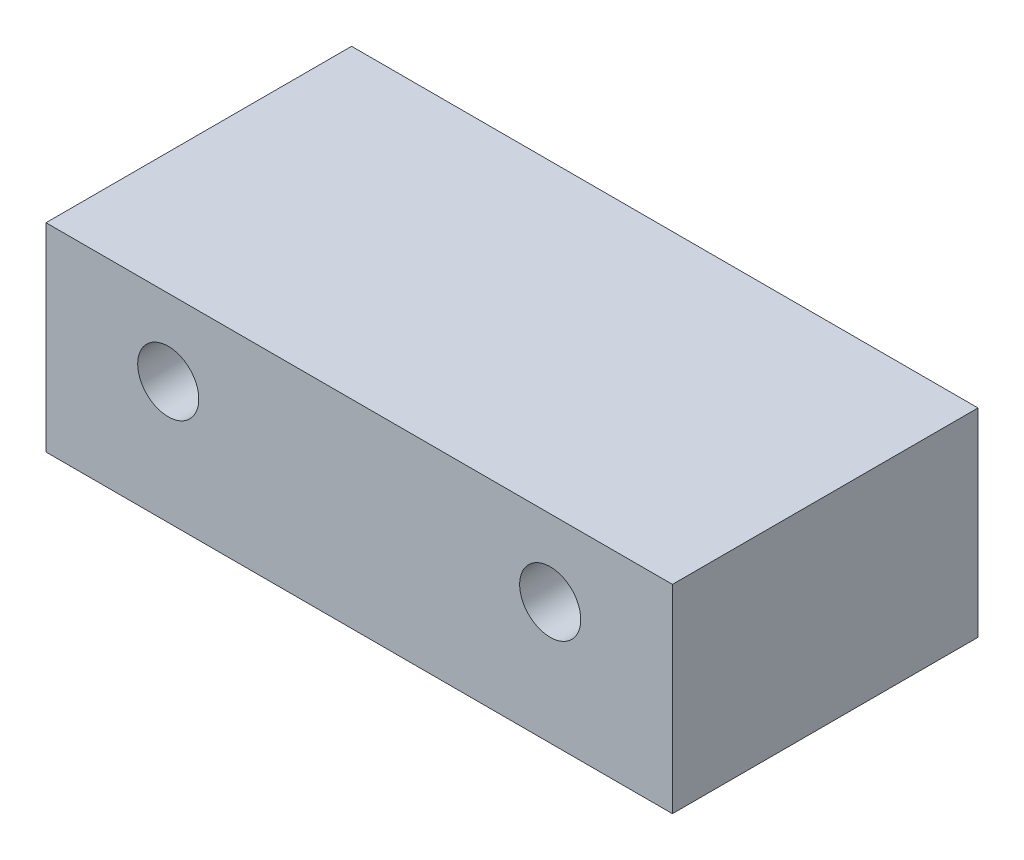
from build123d import *

# Parameters (mm, degrees)
SKETCH_1_W      = 41
SKETCH_1_H      = 10
SKETCH_1_R      = 2
EXTRUDE_1_DEPTH = 20
SKETCH_2_W      = 41
SKETCH_2_H      = 3
EXTRUDE_2_DEPTH = 20


with BuildPart() as part:
    # 草图1 → 凸台-拉伸1 (new body)
    with BuildSketch(Plane.XY):
        Rectangle(SKETCH_1_W, SKETCH_1_H)
        with Locations((12.5, 0)):
            Circle(SKETCH_1_R, mode=Mode.SUBTRACT)
        with Locations(Location((-12.5, 0, 0), (0, 0, 180))):
            Circle(SKETCH_1_R, mode=Mode.SUBTRACT)
    extrude(amount=EXTRUDE_1_DEPTH)

    # 草图2 → 凸台-拉伸2 (add)
    with BuildSketch(Plane.XY.offset(20)):
        with Locations((0, -6.5)):
            Rectangle(SKETCH_2_W, SKETCH_2_H)
    extrude(amount=-EXTRUDE_2_DEPTH)


solid = part.part
